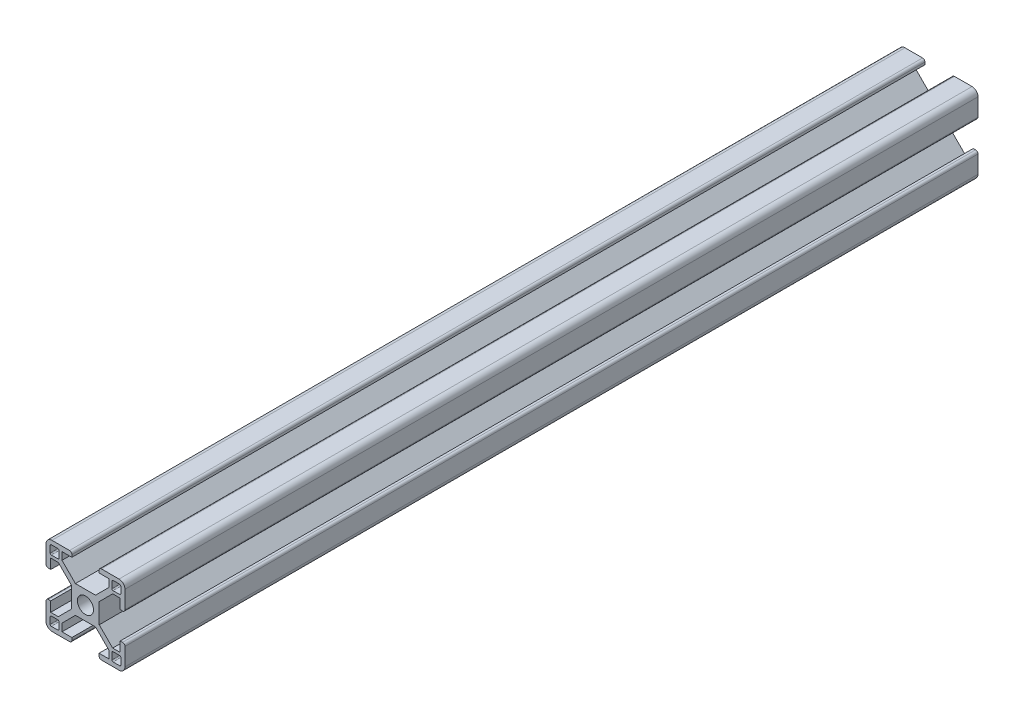
from build123d import *

# Parameters (mm, degrees)
CROQUIS1_R              = 3.4
SALIENTE_EXTRUIR1_DEPTH = 360


with BuildPart() as part:
    # Croquis1 → Saliente-Extruir1 (new body)
    with BuildSketch(Plane.XY):
        with BuildLine():
            Line((-4.433640906, 1.227432273), (-4.433640906, 9.707432273))
            Line((-4.433640906, 9.707432273), (1.236359094, 15.377432273))
            Line((1.236359094, 15.377432273), (4.426359094, 15.377432273))
            Line((4.426359094, 15.377432273), (4.426359094, 11.197432273))
            Line((4.426359094, 11.197432273), (5.426359094, 11.197432273))
            ThreePointArc((5.426359094, 11.197432273), (6.133465875, 11.490325492), (6.426359094, 12.197432273))
            Line((6.426359094, 12.197432273), (6.426359094, 19.627432273))
            ThreePointArc((6.426359094, 19.627432273), (5.694126047, 21.395199226), (3.926359094, 22.127432273))
            Line((3.926359094, 22.127432273), (-3.503640906, 22.127432273))
            ThreePointArc((-3.503640906, 22.127432273), (-4.210747688, 21.834539054), (-4.503640906, 21.127432273))
            Line((-4.503640906, 21.127432273), (-4.503640906, 20.127432273))
            Line((-4.503640906, 20.127432273), (-0.323640906, 20.127432273))
            Line((-0.323640906, 20.127432273), (-0.323640906, 16.937432273))
            Line((-0.323640906, 16.937432273), (-5.993640906, 11.267432273))
            Line((-5.993640906, 11.267432273), (-14.473640906, 11.267432273))
            Line((-14.473640906, 11.267432273), (-20.143640906, 16.937432273))
            Line((-20.143640906, 16.937432273), (-20.143640906, 20.127432273))
            Line((-20.143640906, 20.127432273), (-15.963640906, 20.127432273))
            Line((-15.963640906, 20.127432273), (-15.963640906, 21.127432273))
            ThreePointArc((-15.963640906, 21.127432273), (-16.256534125, 21.834539054), (-16.963640906, 22.127432273))
            Line((-16.963640906, 22.127432273), (-24.393640906, 22.127432273))
            ThreePointArc((-24.393640906, 22.127432273), (-26.161407859, 21.395199226), (-26.893640906, 19.627432273))
            Line((-26.893640906, 19.627432273), (-26.893640906, 12.197432273))
            ThreePointArc((-26.893640906, 12.197432273), (-26.600747688, 11.490325492), (-25.893640906, 11.197432273))
            Line((-25.893640906, 11.197432273), (-24.893640906, 11.197432273))
            Line((-24.893640906, 11.197432273), (-24.893640906, 15.377432273))
            Line((-24.893640906, 15.377432273), (-21.703640906, 15.377432273))
            Line((-21.703640906, 15.377432273), (-16.033640906, 9.707432273))
            Line((-16.033640906, 9.707432273), (-16.033640906, 1.227432273))
            Line((-16.033640906, 1.227432273), (-21.703640906, -4.442567727))
            Line((-21.703640906, -4.442567727), (-24.893640906, -4.442567727))
            Line((-24.893640906, -4.442567727), (-24.893640906, -0.262567727))
            Line((-24.893640906, -0.262567727), (-25.893640906, -0.262567727))
            ThreePointArc((-25.893640906, -0.262567727), (-26.600747688, -0.555460946), (-26.893640906, -1.262567727))
            Line((-26.893640906, -1.262567727), (-26.893640906, -8.692567727))
            ThreePointArc((-26.893640906, -8.692567727), (-26.161407859, -10.46033468), (-24.393640906, -11.192567727))
            Line((-24.393640906, -11.192567727), (-16.963640906, -11.192567727))
            ThreePointArc((-16.963640906, -11.192567727), (-16.256534125, -10.899674508), (-15.963640906, -10.192567727))
            Line((-15.963640906, -10.192567727), (-15.963640906, -9.192567727))
            Line((-15.963640906, -9.192567727), (-20.143640906, -9.192567727))
            Line((-20.143640906, -9.192567727), (-20.143640906, -6.002567727))
            Line((-20.143640906, -6.002567727), (-14.473640906, -0.332567727))
            Line((-14.473640906, -0.332567727), (-5.993640906, -0.332567727))
            Line((-5.993640906, -0.332567727), (-0.323640906, -6.002567727))
            Line((-0.323640906, -6.002567727), (-0.323640906, -9.192567727))
            Line((-0.323640906, -9.192567727), (-4.503640906, -9.192567727))
            Line((-4.503640906, -9.192567727), (-4.503640906, -10.192567727))
            ThreePointArc((-4.503640906, -10.192567727), (-4.210747688, -10.899674508), (-3.503640906, -11.192567727))
            Line((-3.503640906, -11.192567727), (3.926359094, -11.192567727))
            ThreePointArc((3.926359094, -11.192567727), (5.694126047, -10.46033468), (6.426359094, -8.692567727))
            Line((6.426359094, -8.692567727), (6.426359094, -1.262567727))
            ThreePointArc((6.426359094, -1.262567727), (6.133465875, -0.555460946), (5.426359094, -0.262567727))
            Line((5.426359094, -0.262567727), (4.426359094, -0.262567727))
            Line((4.426359094, -0.262567727), (4.426359094, -4.442567727))
            Line((4.426359094, -4.442567727), (1.236359094, -4.442567727))
            Line((1.236359094, -4.442567727), (-4.433640906, 1.227432273))
        make_face()
        with Locations(Location((-10.233640906, 5.467432273, 0), (0, 0, 180))):
            Circle(CROQUIS1_R, mode=Mode.SUBTRACT)
        with BuildLine():
            Line((1.417854227, 20.368927407), (4.167854227, 20.368927407))
            ThreePointArc((4.167854227, 20.368927407), (4.521407618, 20.222480798), (4.667854227, 19.868927407))
            Line((4.667854227, 19.868927407), (4.667854227, 17.118927407))
            ThreePointArc((4.667854227, 17.118927407), (4.521407618, 16.765374016), (4.167854227, 16.618927407))
            Line((4.167854227, 16.618927407), (1.417854227, 16.618927407))
            ThreePointArc((1.417854227, 16.618927407), (1.064300837, 16.765374016), (0.917854227, 17.118927407))
            Line((0.917854227, 17.118927407), (0.917854227, 19.868927407))
            ThreePointArc((0.917854227, 19.868927407), (1.064300837, 20.222480798), (1.417854227, 20.368927407))
        make_face(mode=Mode.SUBTRACT)
        with BuildLine():
            Line((-25.13513604, 19.868927407), (-25.13513604, 17.118927407))
            ThreePointArc((-25.13513604, 17.118927407), (-24.988689431, 16.765374016), (-24.63513604, 16.618927407))
            Line((-24.63513604, 16.618927407), (-21.88513604, 16.618927407))
            ThreePointArc((-21.88513604, 16.618927407), (-21.531582649, 16.765374016), (-21.38513604, 17.118927407))
            Line((-21.38513604, 17.118927407), (-21.38513604, 19.868927407))
            ThreePointArc((-21.38513604, 19.868927407), (-21.531582649, 20.222480798), (-21.88513604, 20.368927407))
            Line((-21.88513604, 20.368927407), (-24.63513604, 20.368927407))
            ThreePointArc((-24.63513604, 20.368927407), (-24.988689431, 20.222480798), (-25.13513604, 19.868927407))
        make_face(mode=Mode.SUBTRACT)
        with BuildLine():
            Line((-21.88513604, -9.43406286), (-24.63513604, -9.43406286))
            ThreePointArc((-24.63513604, -9.43406286), (-24.988689431, -9.287616251), (-25.13513604, -8.93406286))
            Line((-25.13513604, -8.93406286), (-25.13513604, -6.18406286))
            ThreePointArc((-25.13513604, -6.18406286), (-24.988689431, -5.83050947), (-24.63513604, -5.68406286))
            Line((-24.63513604, -5.68406286), (-21.88513604, -5.68406286))
            ThreePointArc((-21.88513604, -5.68406286), (-21.531582649, -5.83050947), (-21.38513604, -6.18406286))
            Line((-21.38513604, -6.18406286), (-21.38513604, -8.93406286))
            ThreePointArc((-21.38513604, -8.93406286), (-21.531582649, -9.287616251), (-21.88513604, -9.43406286))
        make_face(mode=Mode.SUBTRACT)
        with BuildLine():
            Line((4.667854227, -8.93406286), (4.667854227, -6.18406286))
            ThreePointArc((4.667854227, -6.18406286), (4.521407618, -5.83050947), (4.167854227, -5.68406286))
            Line((4.167854227, -5.68406286), (1.417854227, -5.68406286))
            ThreePointArc((1.417854227, -5.68406286), (1.064300837, -5.83050947), (0.917854227, -6.18406286))
            Line((0.917854227, -6.18406286), (0.917854227, -8.93406286))
            ThreePointArc((0.917854227, -8.93406286), (1.064300837, -9.287616251), (1.417854227, -9.43406286))
            Line((1.417854227, -9.43406286), (4.167854227, -9.43406286))
            ThreePointArc((4.167854227, -9.43406286), (4.521407618, -9.287616251), (4.667854227, -8.93406286))
        make_face(mode=Mode.SUBTRACT)
    extrude(amount=SALIENTE_EXTRUIR1_DEPTH)


solid = part.part
